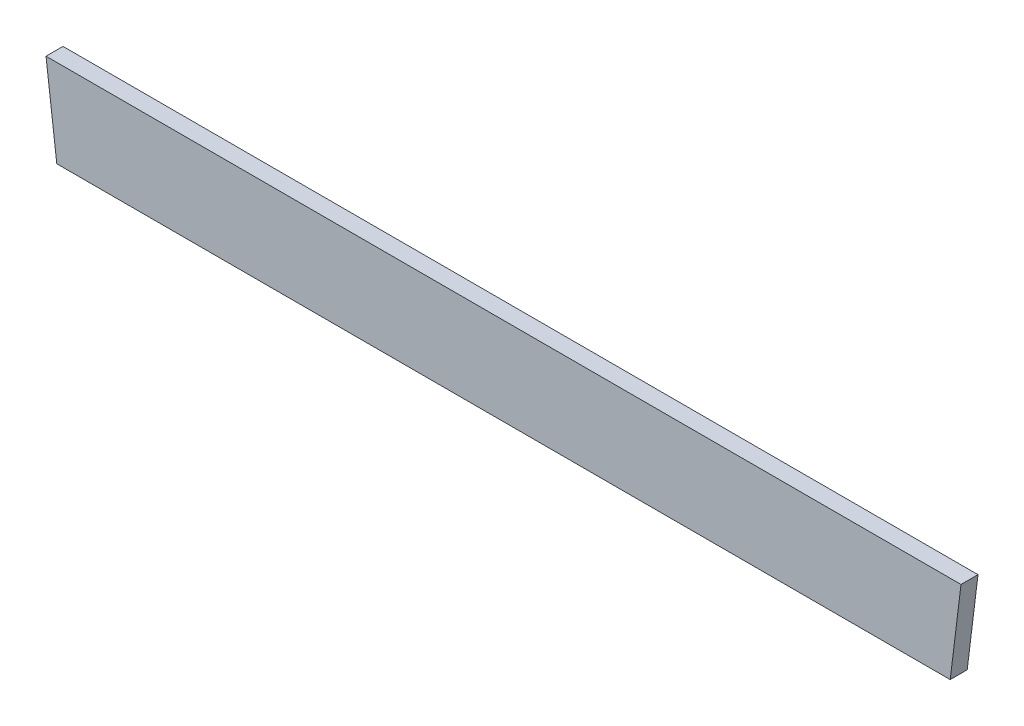
from build123d import *

# Parameters (mm, degrees)
BOSS_EXTRUDE1_DEPTH = 10


with BuildPart() as part:
    # Sketch1 → Boss-Extrude1 (new body)
    with BuildSketch(Plane.XY):
        Polygon((-269.175368733, -62.63989261), (-262.832305131, -114.3), (262.832305131, -114.3), (269.175368733, -62.63989261), align=None)
    extrude(amount=BOSS_EXTRUDE1_DEPTH)


solid = part.part
